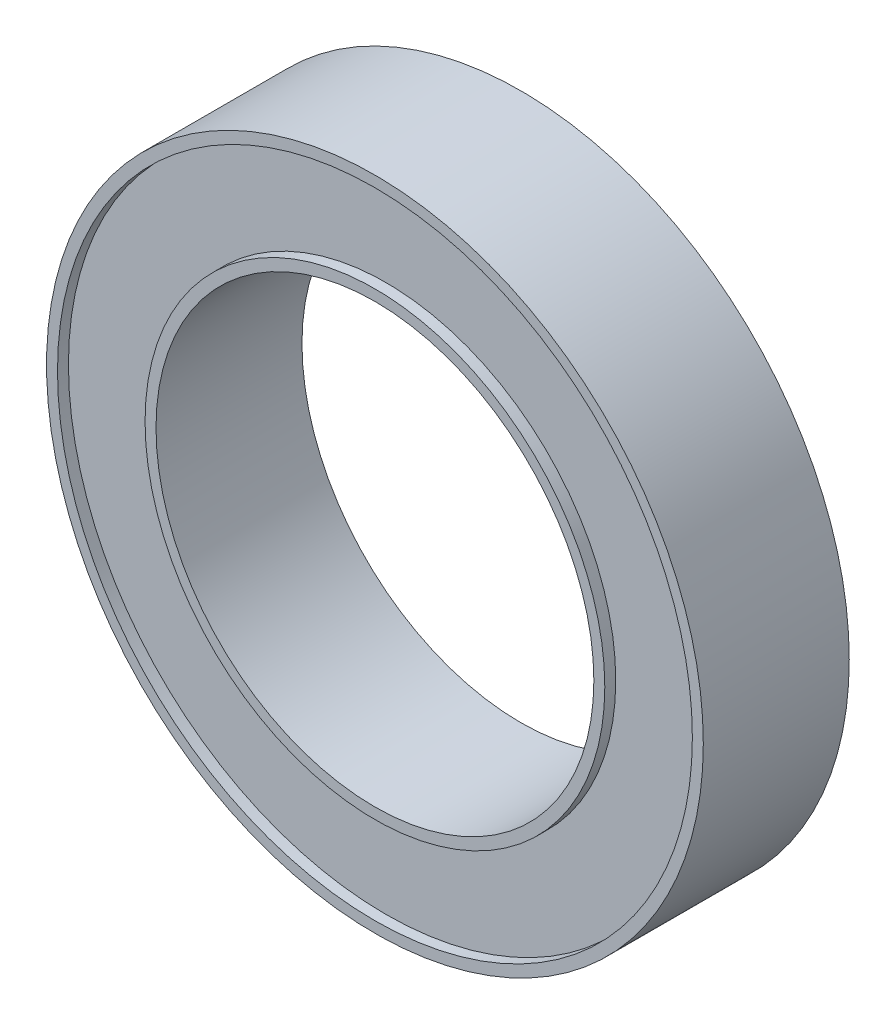
from build123d import *

# Parameters (mm, degrees)
SKETCH_1_R          = 9
SKETCH_1_R_2        = 6
EXTRUDE_1_DEPTH     = 2
SKETCH_2_R          = 8.7
SKETCH_2_R_2        = 6.3
CUT_EXTRUDE_1_DEPTH = 0.3


with BuildPart() as part:
    # 草图1 → 凸台-拉伸1 (new, symmetric)
    with BuildSketch(Plane.XY):
        Circle(SKETCH_1_R)
        Circle(SKETCH_1_R_2, mode=Mode.SUBTRACT)
    extrude(amount=EXTRUDE_1_DEPTH, both=True)

    # 草图2 → 切除-拉伸1 (cut)
    with BuildSketch(Plane.XY.offset(2)):
        Circle(SKETCH_2_R)
        Circle(SKETCH_2_R_2, mode=Mode.SUBTRACT)
    cut_extrude_1 = extrude(amount=-CUT_EXTRUDE_1_DEPTH, mode=Mode.SUBTRACT)

    # 镜向1: 切除-拉伸1 across plane
    add(cut_extrude_1.mirror(Plane.XY), mode=Mode.SUBTRACT)


solid = part.part
